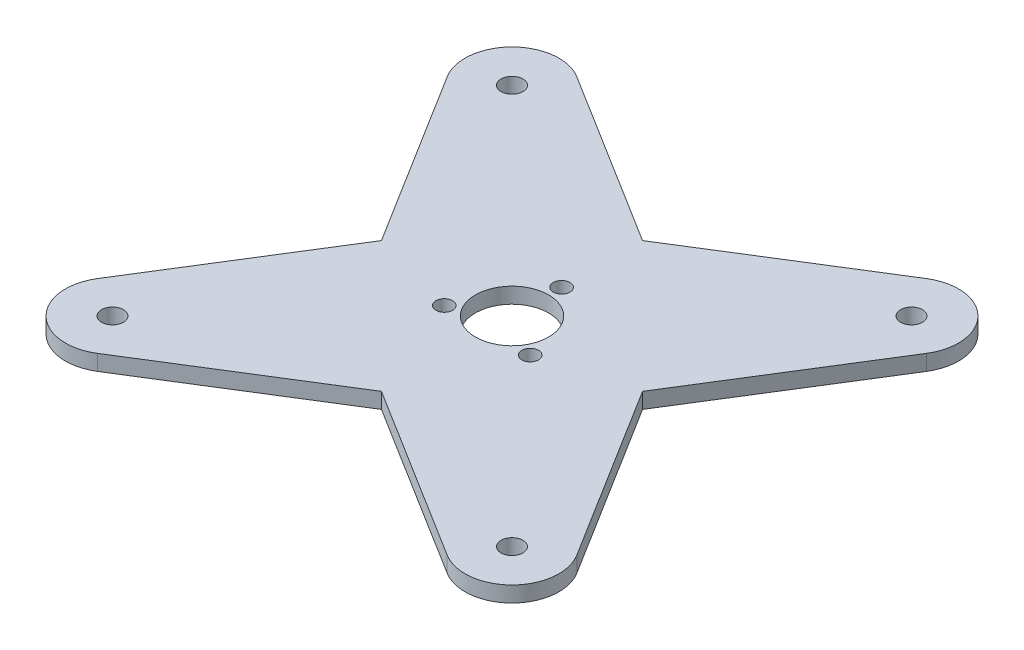
from build123d import *

# Parameters (mm, degrees)
SKETCH_1_R          = 2.1
EXTRUDE_1_DEPTH     = 3
SKETCH_2_R          = 7
SKETCH_2_R_2        = 1.6
CUT_EXTRUDE_1_DEPTH = 10


with BuildPart() as part:
    # 草图1 → 凸台-拉伸1 (new body)
    with BuildSketch(Plane(origin=(0, 0, 0), x_dir=(1, 0, 0), z_dir=(0, 1, 0))):
        with BuildLine():
            Line((-45.88639118, 33.487067107), (-25, 0))
            Line((-25, 0), (-45.88639118, -33.487067107))
            ThreePointArc((-45.88639118, -33.487067107), (-44.613961031, -44.613961031), (-33.487067107, -45.88639118))
            Line((-33.487067107, -45.88639118), (0, -25))
            Line((0, -25), (33.487067107, -45.88639118))
            ThreePointArc((33.487067107, -45.88639118), (44.613961031, -44.613961031), (45.88639118, -33.487067107))
            Line((45.88639118, -33.487067107), (25, 0))
            Line((25, 0), (45.88639118, 33.487067107))
            ThreePointArc((45.88639118, 33.487067107), (44.613961031, 44.613961031), (33.487067107, 45.88639118))
            Line((33.487067107, 45.88639118), (0, 25))
            Line((0, 25), (-33.487067107, 45.88639118))
            ThreePointArc((-33.487067107, 45.88639118), (-44.613961031, 44.613961031), (-45.88639118, 33.487067107))
        make_face()
        with Locations(Location((38.25, 38.25, 0), (0, 0, 270))):
            Circle(SKETCH_1_R, mode=Mode.SUBTRACT)
        with Locations(Location((-38.25, -38.25, 0), (0, 0, 270))):
            Circle(SKETCH_1_R, mode=Mode.SUBTRACT)
        with Locations(Location((38.25, -38.25, 0), (0, 0, 270))):
            Circle(SKETCH_1_R, mode=Mode.SUBTRACT)
        with Locations(Location((-38.25, 38.25, 0), (0, 0, 270))):
            Circle(SKETCH_1_R, mode=Mode.SUBTRACT)
    extrude(amount=EXTRUDE_1_DEPTH)

    # 草图2 → 切除-拉伸1 (cut)
    with BuildSketch(Plane(origin=(0, 3, 0), x_dir=(1, 0, 0), z_dir=(0, 1, 0))):
        with Locations(Location((0, 0, 0), (0, 0, 270))):
            Circle(SKETCH_2_R)
        with Locations(Location((0, 9.5, 0), (0, 0, 270))):
            Circle(SKETCH_2_R_2)
        with Locations(Location((8.227241336, -4.75, 0), (0, 0, 270))):
            Circle(SKETCH_2_R_2)
        with Locations(Location((-8.227241336, -4.75, 0), (0, 0, 270))):
            Circle(SKETCH_2_R_2)
    extrude(amount=-CUT_EXTRUDE_1_DEPTH, mode=Mode.SUBTRACT)


solid = part.part
